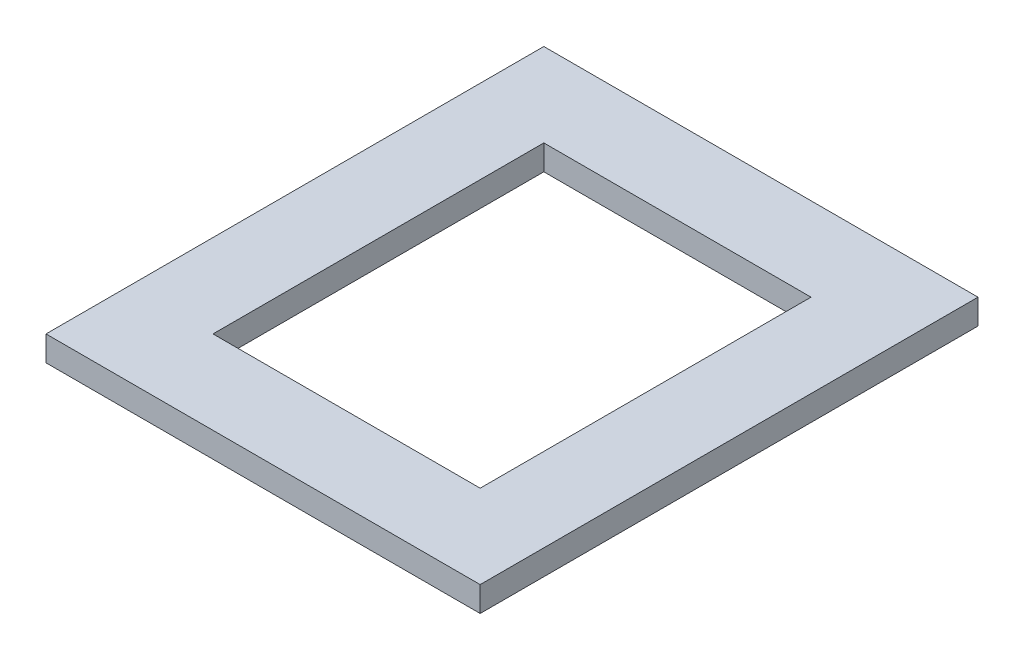
from build123d import *

# Parameters (mm, degrees)
SKETCH1_W           = 52
SKETCH1_H           = 59.625903178
SKETCH1_W_2         = 32
SKETCH1_H_2         = 39.625903178
BOSS_EXTRUDE1_DEPTH = 3


with BuildPart() as part:
    # Sketch1 → Boss-Extrude1 (new body)
    with BuildSketch(Plane(origin=(0, 0, 0), x_dir=(1, 0, 0), z_dir=(0, 1, 0))):
        Rectangle(SKETCH1_W, SKETCH1_H)
        Rectangle(SKETCH1_W_2, SKETCH1_H_2, mode=Mode.SUBTRACT)
    extrude(amount=BOSS_EXTRUDE1_DEPTH)


solid = part.part
